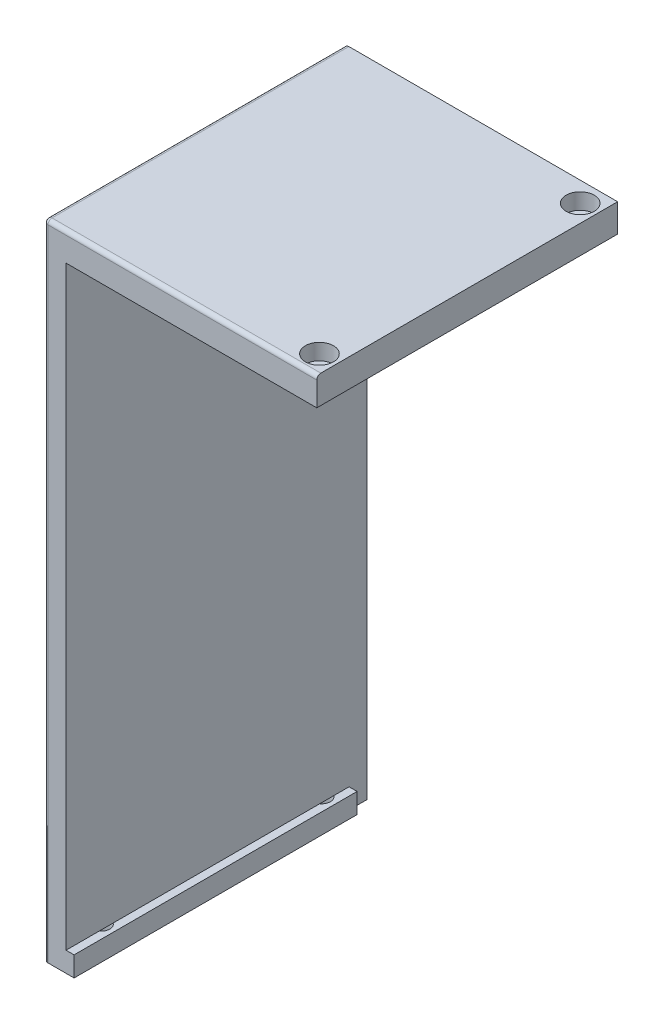
from build123d import *

# Parameters (mm, degrees)
BOSS_EXTRUDE1_DEPTH = 75
CUT_EXTRUDE2_REACH  = 202.429
SKETCH4_R           = 2.05
SKETCH4_3_R         = 3.5
SKETCH4_3_R_2       = 2.05
CUT_EXTRUDE3_DEPTH  = 4
SKETCH5_W           = 70.551930768
SKETCH5_H           = 5
BOSS_EXTRUDE2_DEPTH = 2
SKETCH6_R           = 2.15
CUT_EXTRUDE4_DEPTH  = 5
FILLET1_R           = 1


with BuildPart() as part:
    # Sketch2 → Boss-Extrude1 (new body)
    with BuildSketch(Plane.XY):
        with BuildLine():
            Line((-88.5, -160.346147872), (-88.5, -7))
            Line((-88.5, -7), (-26, -7))
            Line((-26, -7), (-26, 0))
            Line((-26, 0), (-93, 0))
            ThreePointArc((-93, 0), (-93.707106781, -0.292893219), (-94, -1))
            Line((-94, -1), (-94, -160.346147872))
            Line((-94, -160.346147872), (-88.5, -160.346147872))
        make_face()
    extrude(amount=BOSS_EXTRUDE1_DEPTH)

    # Sketch4 → Cut-Extrude2 (cut, up to next)
    with BuildSketch(Plane(origin=(0, 0, 0), x_dir=(1, 0, 0), z_dir=(0, 1, 0)), mode=Mode.PRIVATE) as cut_extrude2_sk1:
        with Locations(Location((-30.341713377, -5, 0), (0, 0, 270))):
            Circle(SKETCH4_R)
    cut_extrude2_tool1 = extrude(cut_extrude2_sk1.sketch, amount=-CUT_EXTRUDE2_REACH, mode=Mode.PRIVATE) & part.part
    # Sketch4 → Cut-Extrude2 (cut, up to next)
    with BuildSketch(Plane(origin=(0, 0, 0), x_dir=(1, 0, 0), z_dir=(0, 1, 0)), mode=Mode.PRIVATE) as cut_extrude2_sk2:
        with Locations(Location((-30.341713377, -70, 0), (0, 0, 270))):
            Circle(SKETCH4_R)
    cut_extrude2_tool2 = extrude(cut_extrude2_sk2.sketch, amount=-CUT_EXTRUDE2_REACH, mode=Mode.PRIVATE) & part.part
    add(cut_extrude2_tool1.solids().sort_by_distance((-30.341713, 0, 5))[0], mode=Mode.SUBTRACT)
    add(cut_extrude2_tool2.solids().sort_by_distance((-30.341713, 0, 70))[0], mode=Mode.SUBTRACT)

    # Sketch4<3> → Cut-Extrude3 (cut)
    # profile 1 of 2: a face of its own
    with BuildSketch(Plane(origin=(0, 0, 0), x_dir=(1, 0, 0), z_dir=(0, 1, 0))):
        with Locations(Location((-30.341713377, -5, 0), (0, 0, 270))):
            Circle(SKETCH4_3_R)
        with Locations(Location((-30.341713377, -5, 0), (0, 0, 270))):
            Circle(SKETCH4_3_R_2, mode=Mode.SUBTRACT)
    # profile 2 of 2: a face of its own
    with BuildSketch(Plane(origin=(0, 0, 0), x_dir=(1, 0, 0), z_dir=(0, 1, 0))):
        with Locations(Location((-30.341713377, -70, 0), (0, 0, 270))):
            Circle(SKETCH4_3_R)
        with Locations(Location((-30.341713377, -70, 0), (0, 0, 270))):
            Circle(SKETCH4_3_R_2, mode=Mode.SUBTRACT)
    extrude(amount=-CUT_EXTRUDE3_DEPTH, mode=Mode.SUBTRACT)

    # Sketch5 → Boss-Extrude2 (add)
    with BuildSketch(Plane(origin=(-88.5, 0, 0), x_dir=(0, 0, -1), z_dir=(1, 0, 0))):
        with Locations((-39.724034616, -157.846147872)):
            Rectangle(SKETCH5_W, SKETCH5_H)
    extrude(amount=BOSS_EXTRUDE2_DEPTH)

    # Sketch6 → Cut-Extrude4 (cut)
    with BuildSketch(Plane.XZ.offset(160.346147872)):
        with Locations(Location((-89.75, 10, 0), (0, 0, 270))):
            Circle(SKETCH6_R)
        with Locations(Location((-89.75, 65, 0), (0, 0, 270))):
            Circle(SKETCH6_R)
    extrude(amount=-CUT_EXTRUDE4_DEPTH, mode=Mode.SUBTRACT)

    # Fillet1
    fillet1_edges = [part.edges().sort_by_distance(p)[0] for p in [
        (-94, -80.673073936, 75),
        (-93.707106781, -0.292893219, 75),
        (-59.5, 0, 75),
    ]]
    fillet(fillet1_edges, radius=FILLET1_R)


solid = part.part
